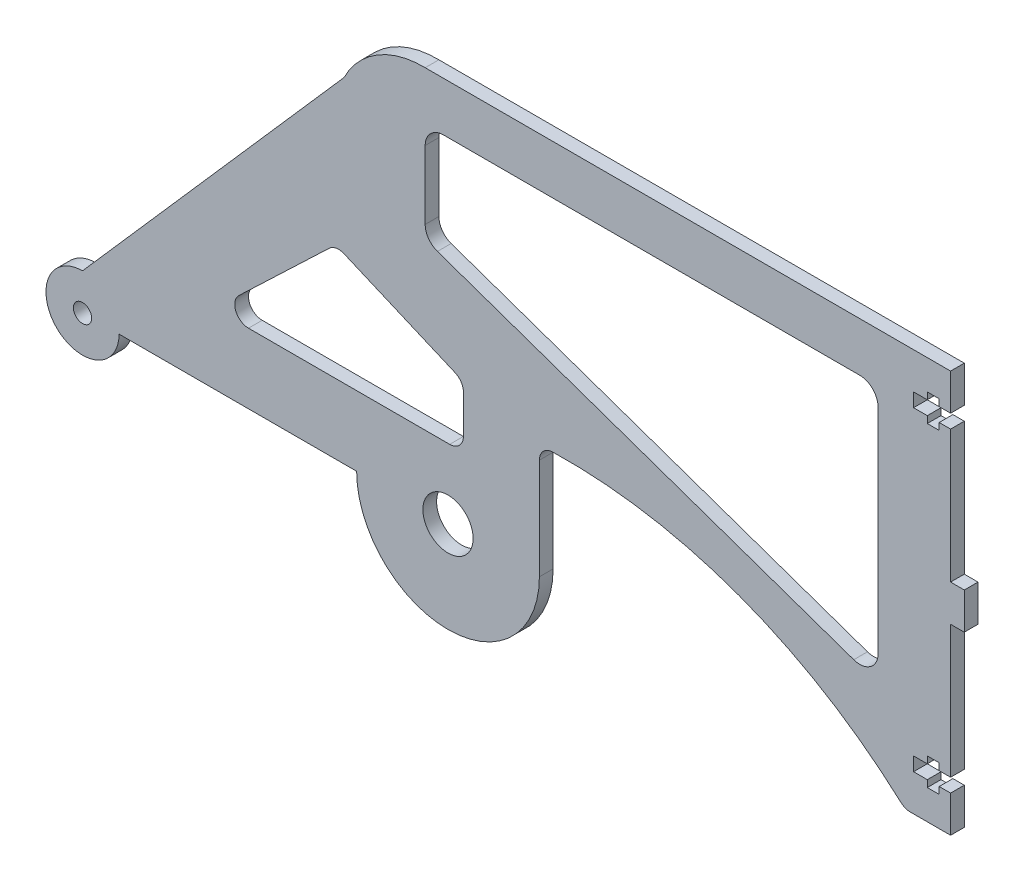
from build123d import *

# Parameters (mm, degrees)
SKETCH_1_R      = 2
SKETCH_1_R_2    = 5.5
EXTRUDE_1_DEPTH = 3


with BuildPart() as part:
    # 草图1 → 凸台-拉伸1 (new body)
    with BuildSketch(Plane.XY):
        with BuildLine():
            Line((234.002581869, 13.707860978), (182.002581869, 13.707860978))
            ThreePointArc((182.002581869, 13.707860978), (168.34572762, 8.051006728), (174.002581869, 21.707860978))
            Line((174.002581869, 21.707860978), (231.242343182, 86.967009497))
            ThreePointArc((231.242343182, 86.967009497), (238.565892024, 94.911259453), (249.002581869, 97.707860978))
            Line((249.002581869, 97.707860978), (354.002581869, 97.707860978))
            Line((354.002581869, 97.707860978), (364.002581869, 97.707860978))
            Line((364.002581869, 97.707860978), (364.002581869, 89.707860978))
            Line((364.002581869, 89.707860978), (361.502581869, 89.707860978))
            Line((361.502581869, 89.707860978), (361.502581869, 91.207860978))
            Line((361.502581869, 91.207860978), (358.902581869, 91.207860978))
            Line((358.902581869, 91.207860978), (358.902581869, 89.707860978))
            Line((358.902581869, 89.707860978), (355.902581869, 89.707860978))
            Line((355.902581869, 89.707860978), (355.902581869, 86.707860978))
            Line((355.902581869, 86.707860978), (358.902581869, 86.707860978))
            Line((358.902581869, 86.707860978), (358.902581869, 85.207860978))
            Line((358.902581869, 85.207860978), (361.502581869, 85.207860978))
            Line((361.502581869, 85.207860978), (361.502581869, 86.707860978))
            Line((361.502581869, 86.707860978), (364.002581869, 86.707860978))
            Line((364.002581869, 86.707860978), (364.002581869, 57.707860978))
            Line((364.002581869, 57.707860978), (367.002581869, 57.707860978))
            Line((367.002581869, 57.707860978), (367.002581869, 49.707860978))
            Line((367.002581869, 49.707860978), (364.002581869, 49.707860978))
            Line((364.002581869, 49.707860978), (364.002581869, 20.707860978))
            Line((364.002581869, 20.707860978), (361.502581869, 20.707860978))
            Line((361.502581869, 20.707860978), (361.502581869, 22.207860978))
            Line((361.502581869, 22.207860978), (358.902581869, 22.207860978))
            Line((358.902581869, 22.207860978), (358.902581869, 20.707860978))
            Line((358.902581869, 20.707860978), (355.902581869, 20.707860978))
            Line((355.902581869, 20.707860978), (355.902581869, 17.707860978))
            Line((355.902581869, 17.707860978), (358.902581869, 17.707860978))
            Line((358.902581869, 17.707860978), (358.902581869, 16.207860978))
            Line((358.902581869, 16.207860978), (361.502581869, 16.207860978))
            Line((361.502581869, 16.207860978), (361.502581869, 17.707860978))
            Line((361.502581869, 17.707860978), (364.002581869, 17.707860978))
            Line((364.002581869, 17.707860978), (364.002581869, 9.707860978))
            Line((364.002581869, 9.707860978), (355.16842929, 9.707860978))
            ThreePointArc((355.16842929, 9.707860978), (354.089046944, 9.908765811), (353.154233351, 10.484571811))
            ThreePointArc((353.154233351, 10.484571811), (317.768023154, 31.985283132), (276.929619495, 38.818236083))
            ThreePointArc((276.929619495, 38.818236083), (274.855620398, 37.914488932), (274.002581869, 35.819123465))
            Line((274.002581869, 35.819123465), (274.002581869, 13.707860978))
            ThreePointArc((274.002581869, 13.707860978), (254.002581869, -6.292139022), (234.002581869, 13.707860978))
        make_face()
        with Locations((174.002581869, 13.707860978)):
            Circle(SKETCH_1_R, mode=Mode.SUBTRACT)
        with Locations((254.002581869, 13.707860978)):
            Circle(SKETCH_1_R_2, mode=Mode.SUBTRACT)
        with BuildLine():
            Line((253.002581869, 86.967009497), (344.129272471, 86.967009497))
            ThreePointArc((344.129272471, 86.967009497), (346.957699596, 85.795436622), (348.129272471, 82.967009497))
            Line((348.129272471, 82.967009497), (348.129272471, 36.172406577))
            ThreePointArc((348.129272471, 36.172406577), (346.444858552, 32.910802508), (342.810241921, 32.396144085))
            Line((342.810241921, 32.396144085), (251.683551319, 64.226264226))
            ThreePointArc((251.683551319, 64.226264226), (249.740977801, 65.686940637), (249.002581869, 68.002526718))
            Line((249.002581869, 68.002526718), (249.002581869, 82.967009497))
            ThreePointArc((249.002581869, 82.967009497), (250.174154745, 85.795436622), (253.002581869, 86.967009497))
        make_face(mode=Mode.SUBTRACT)
        with BuildLine():
            Line((255.549578652, 43.172566622), (249.002581869, 45.970414811))
            Line((249.002581869, 45.970414811), (231.242343182, 53.560223281))
            ThreePointArc((231.242343182, 53.560223281), (229.530107584, 53.753780798), (227.993824006, 52.973365511))
            Line((227.993824006, 52.973365511), (208.259363433, 34.167429409))
            ThreePointArc((208.259363433, 34.167429409), (207.543711742, 30.881045102), (210.328975867, 28.99563191))
            Line((210.328975867, 28.99563191), (254.37067191, 28.99563191))
            ThreePointArc((254.37067191, 28.99563191), (256.491992253, 29.874311567), (257.37067191, 31.99563191))
            Line((257.37067191, 31.99563191), (257.37067191, 40.413911353))
            ThreePointArc((257.37067191, 40.413911353), (256.87434124, 42.066678695), (255.549578652, 43.172566622))
        make_face(mode=Mode.SUBTRACT)
    extrude(amount=EXTRUDE_1_DEPTH)


solid = part.part
